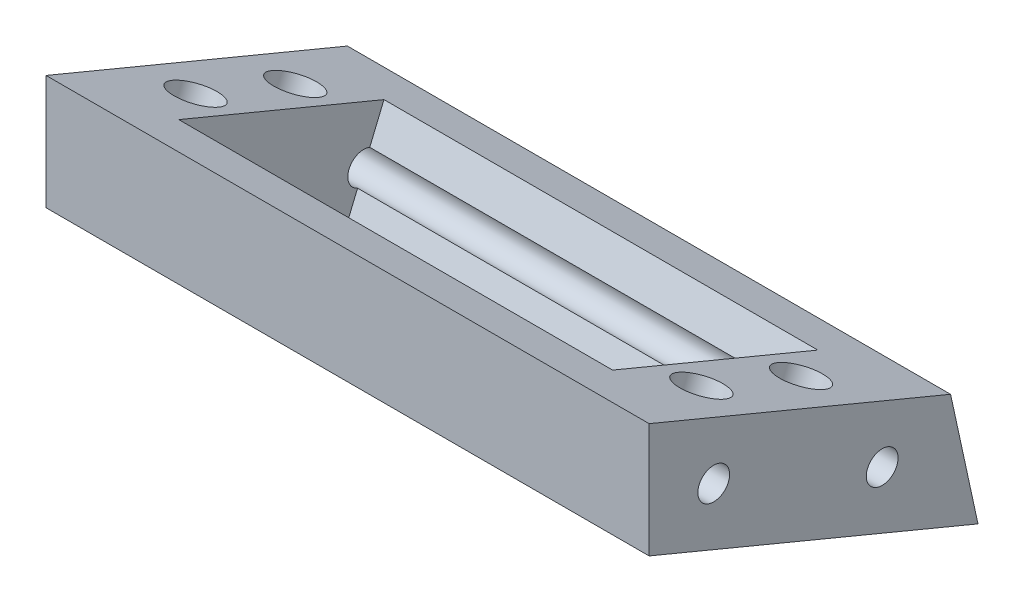
from build123d import *

# Parameters (mm, degrees)
SALIENTE_EXTRUIR1_DEPTH = 57
CROQUIS2_W              = 41
CROQUIS2_H              = 21
CORTAR_EXTRUIR1_DEPTH   = 40
CROQUIS3_R              = 1.5
CORTAR_EXTRUIR2_DEPTH   = 96.265502635
CROQUIS4_R              = 2.2
CORTAR_EXTRUIR3_DEPTH   = 95


with BuildPart() as part:
    # Croquis1 → Saliente-Extruir1 (new body)
    with BuildSketch(Plane(origin=(0, 0, 0), x_dir=(0, 0, -1), z_dir=(1, 0, 0))):
        Polygon((-1.684944658, 59.616081723), (-1.684944658, 70.445194562), (26.80274982, 58.606617394), (29.39371626, 46.700781546), align=None)
    extrude(amount=SALIENTE_EXTRUIR1_DEPTH)

    # Croquis2 → Cortar-Extruir1 (cut)
    with BuildSketch(Plane(origin=(0, 59.474011024, -24.71550197), x_dir=(1, 0, 0), z_dir=(0, 0.9234366793713986, -0.38375082956460804))):
        with Locations((28.5, -13.164518651)):
            Rectangle(CROQUIS2_W, CROQUIS2_H)
    extrude(amount=-CORTAR_EXTRUIR1_DEPTH, mode=Mode.SUBTRACT)

    # Croquis3 → Cortar-Extruir2 (cut, through all)
    with BuildSketch(Plane.ZY):
        with Locations((-20.337749265, 55.878708995)):
            Circle(CROQUIS3_R)
        with Locations((-4.419674199, 62.493753261)):
            Circle(CROQUIS3_R)
    extrude(amount=-CORTAR_EXTRUIR2_DEPTH, mode=Mode.SUBTRACT)

    # Croquis4 → Cortar-Extruir3 (cut)
    with BuildSketch(Plane(origin=(0, 59.474011024, -24.71550197), x_dir=(1, 0, 0), z_dir=(0, 0.9234366793713987, -0.3837508295646078))):
        with Locations(Location((4.6, -18.264518651, 0), (0, 0, 270))):
            Circle(CROQUIS4_R)
        with Locations(Location((4.6, -8.064518651, 0), (0, 0, 270))):
            Circle(CROQUIS4_R)
        with Locations(Location((52.4, -18.264518651, 0), (0, 0, 270))):
            Circle(CROQUIS4_R)
        with Locations(Location((52.4, -8.064518651, 0), (0, 0, 270))):
            Circle(CROQUIS4_R)
    extrude(amount=-CORTAR_EXTRUIR3_DEPTH, mode=Mode.SUBTRACT)


solid = part.part
